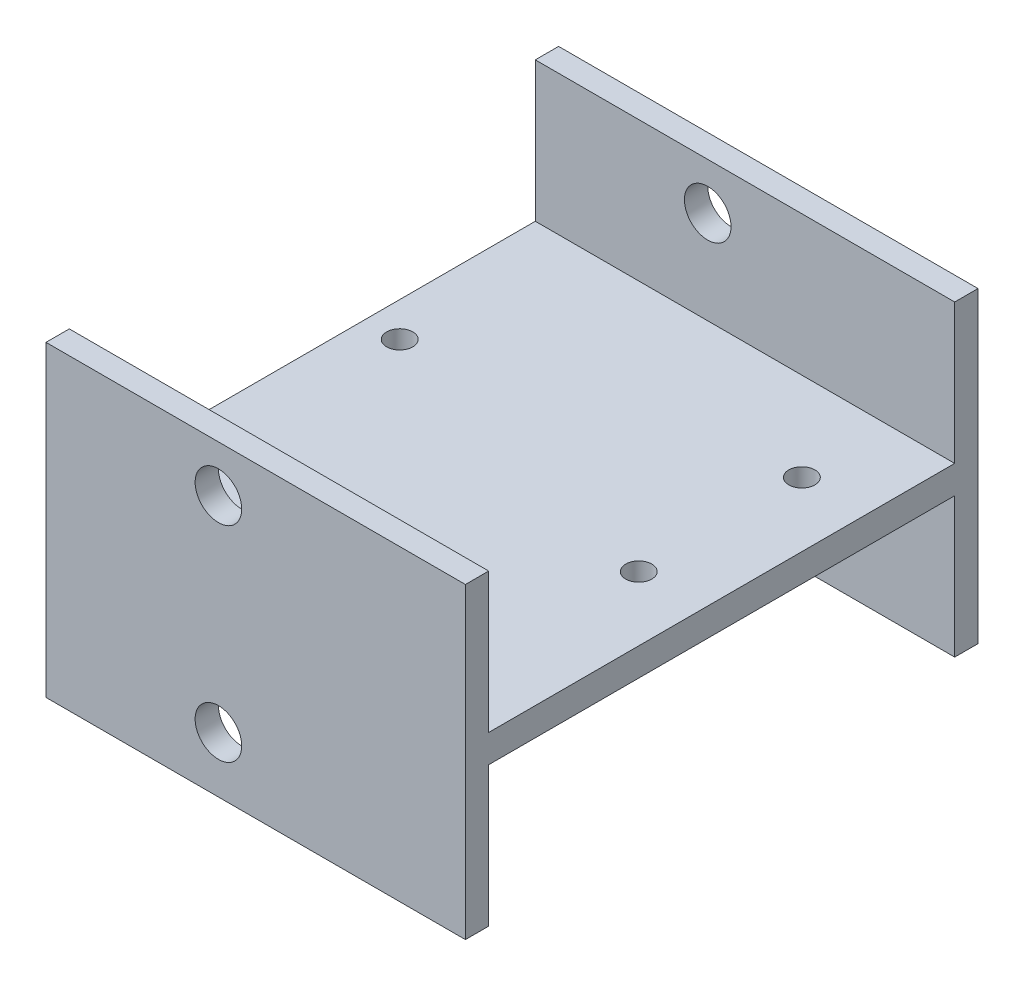
from build123d import *

# Parameters (mm, degrees)
ESQUISSE1_W             = 45
ESQUISSE1_H             = 3
BOSS_EXTRU_1_DEPTH      = 55
ESQUISSE2_R             = 1.4
ENL_V_MAT_EXTRU_1_DEPTH = 50
ESQUISSE3_W             = 45
ESQUISSE3_H             = 2.5
BOSS_EXTRU_2_DEPTH      = 15
ESQUISSE4_R             = 2.5
ENL_V_MAT_EXTRU_2_DEPTH = 65
ESQUISSE5_W             = 45
ESQUISSE5_H             = 2.5
BOSS_EXTRU_3_DEPTH      = 15
ESQUISSE6_R             = 2.5
ENL_V_MAT_EXTRU_3_DEPTH = 65


with BuildPart() as part:
    # Esquisse1 → Boss.-Extru.1 (new body)
    with BuildSketch(Plane.XY):
        with Locations((19.426229508, 2.225409836)):
            Rectangle(ESQUISSE1_W, ESQUISSE1_H)
    extrude(amount=BOSS_EXTRU_1_DEPTH)

    # Esquisse2 → Enlèv. mat.-Extru.1 (cut)
    with BuildSketch(Plane.XZ.offset(-0.725409836)):
        with Locations((0.626229508, 20.75)):
            Circle(ESQUISSE2_R)
        with Locations((35.026229508, 12)):
            Circle(ESQUISSE2_R)
        with Locations((35.026229508, 29.5)):
            Circle(ESQUISSE2_R)
    extrude(amount=-ENL_V_MAT_EXTRU_1_DEPTH, mode=Mode.SUBTRACT)

    # Esquisse3 → Boss.-Extru.2 (add)
    with BuildSketch(Plane.XZ.offset(-0.725409836)):
        with Locations((19.426229508, 53.75)):
            Rectangle(ESQUISSE3_W, ESQUISSE3_H)
        with Locations((19.426229508, 1.25)):
            Rectangle(ESQUISSE3_W, ESQUISSE3_H)
    extrude(amount=BOSS_EXTRU_2_DEPTH)

    # Esquisse4 → Enlèv. mat.-Extru.2 (cut)
    with BuildSketch(Plane.XY.offset(55)):
        with Locations((15.426229508, -8.274590164)):
            Circle(ESQUISSE4_R)
    extrude(amount=-ENL_V_MAT_EXTRU_2_DEPTH, mode=Mode.SUBTRACT)

    # Esquisse5 → Boss.-Extru.3 (add)
    with BuildSketch(Plane(origin=(0, 3.725409836, 0), x_dir=(1, 0, 0), z_dir=(0, 1, 0))):
        with Locations((19.426229508, -53.75)):
            Rectangle(ESQUISSE5_W, ESQUISSE5_H)
        with Locations((19.426229508, -1.25)):
            Rectangle(ESQUISSE5_W, ESQUISSE5_H)
    extrude(amount=BOSS_EXTRU_3_DEPTH)

    # Esquisse6 → Enlèv. mat.-Extru.3 (cut)
    with BuildSketch(Plane.XY.offset(55)):
        with Locations((15.426229508, 13.725409836)):
            Circle(ESQUISSE6_R)
    extrude(amount=-ENL_V_MAT_EXTRU_3_DEPTH, mode=Mode.SUBTRACT)


solid = part.part
